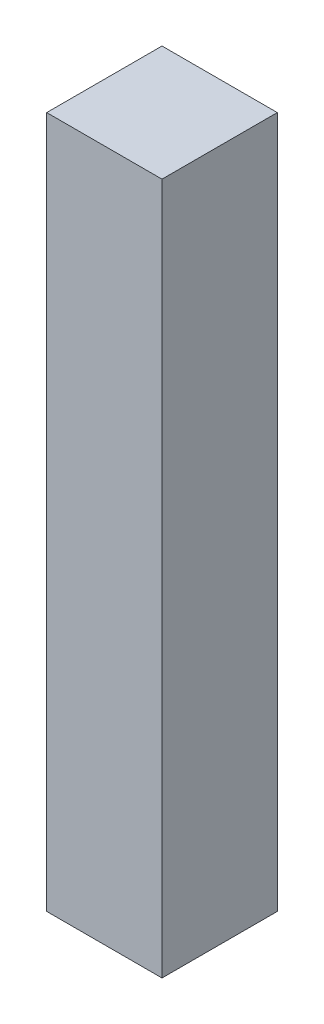
from build123d import *

# Parameters (mm, degrees)
SKETCH1_W           = 5
SKETCH1_H           = 5
BOSS_EXTRUDE1_DEPTH = 30


with BuildPart() as part:
    # Sketch1 → Boss-Extrude1 (new body)
    with BuildSketch(Plane(origin=(0, 0, 0), x_dir=(1, 0, 0), z_dir=(0, 1, 0))):
        with Locations((2.5, 2.5)):
            Rectangle(SKETCH1_W, SKETCH1_H)
    extrude(amount=BOSS_EXTRUDE1_DEPTH)


solid = part.part
